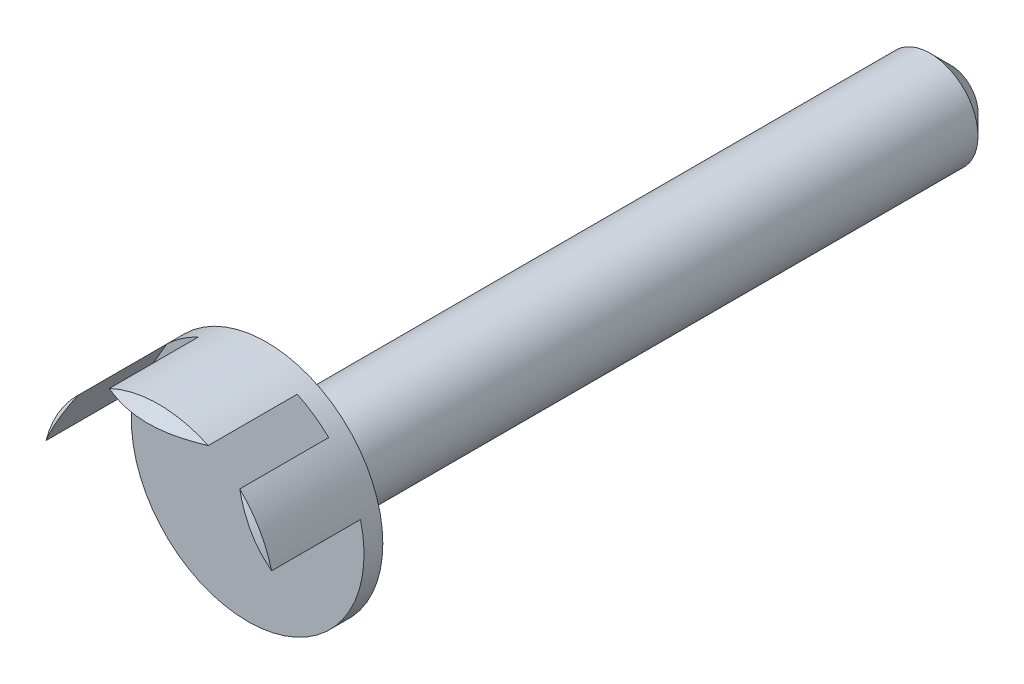
from build123d import *

# Parameters (mm, degrees)
SKETCH1_R          = 1.778
EXTRUDE1_DEPTH     = 25.4
SKETCH3_R          = 4.318
EXTRUDE3_DEPTH     = 4.7625
CHAMFER1_SIZE      = 0.762
CUT_EXTRUDE1_DEPTH = 4.064


with BuildPart() as part:
    # Sketch1 → Extrude1 (new body)
    with BuildSketch(Plane.XY):
        Circle(SKETCH1_R)
    extrude(amount=EXTRUDE1_DEPTH)

    # Sketch3 → Extrude3 (add)
    with BuildSketch(Plane.XY.offset(25.4)):
        with Locations(Location((0, 0.491553118, 0), (0, 0, 180))):
            Circle(SKETCH3_R)
    extrude(amount=EXTRUDE3_DEPTH)

    # Chamfer1
    chamfer1_edges = [part.edges().sort_by_distance(p)[0] for p in [
        (-1.778, 0, 0),
        (4.318, 0.491553118, 30.1625),
    ]]
    chamfer(chamfer1_edges, length=CHAMFER1_SIZE)

    # Sketch4 → Cut-Extrude1 (cut)
    with BuildSketch(Plane.XY.offset(30.1625)):
        Polygon((5.08, 0), (2.54, 4.399409051), (-2.54, 4.399409051), (-5.08, 0), (-2.54, -4.399409051), (2.54, -4.399409051), align=None)
    extrude(amount=-CUT_EXTRUDE1_DEPTH, mode=Mode.SUBTRACT)


solid = part.part
